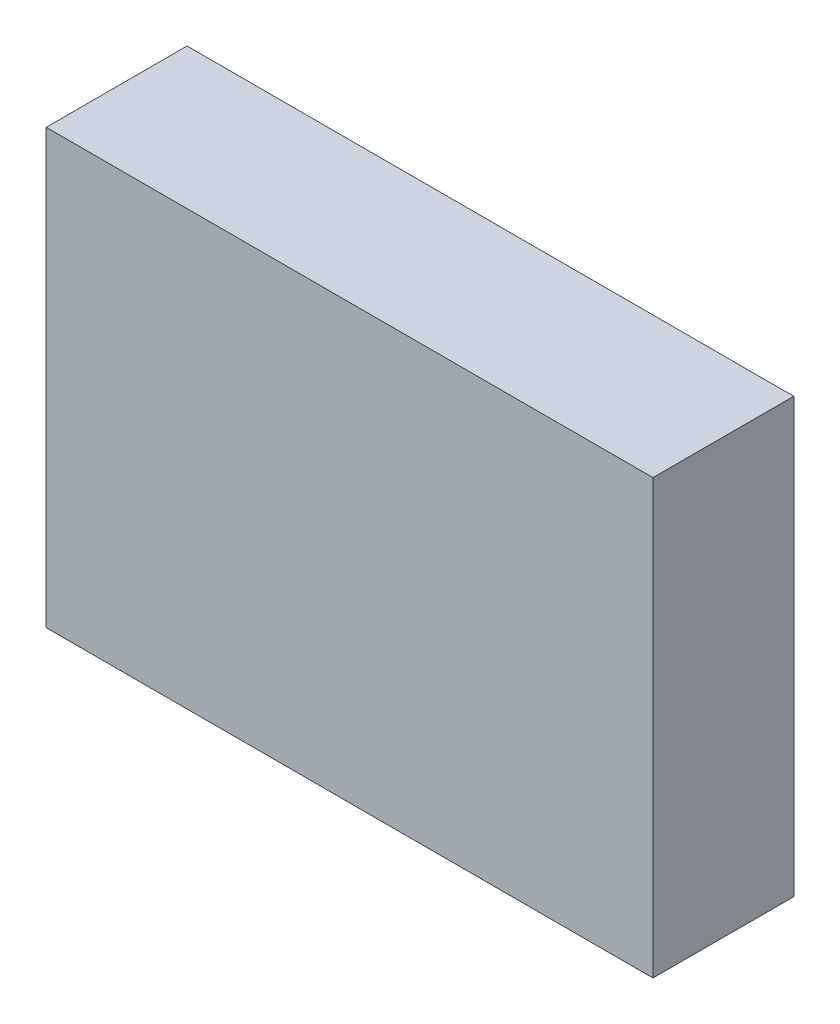
from build123d import *

# Parameters (mm, degrees)
SKETCH_2_W      = 560
SKETCH_2_H      = 400
EXTRUDE_1_DEPTH = 130


with BuildPart() as part:
    # 스케치2 → 보스-돌출1 (new body)
    with BuildSketch(Plane.XY):
        Rectangle(SKETCH_2_W, SKETCH_2_H)
    extrude(amount=EXTRUDE_1_DEPTH)


solid = part.part
